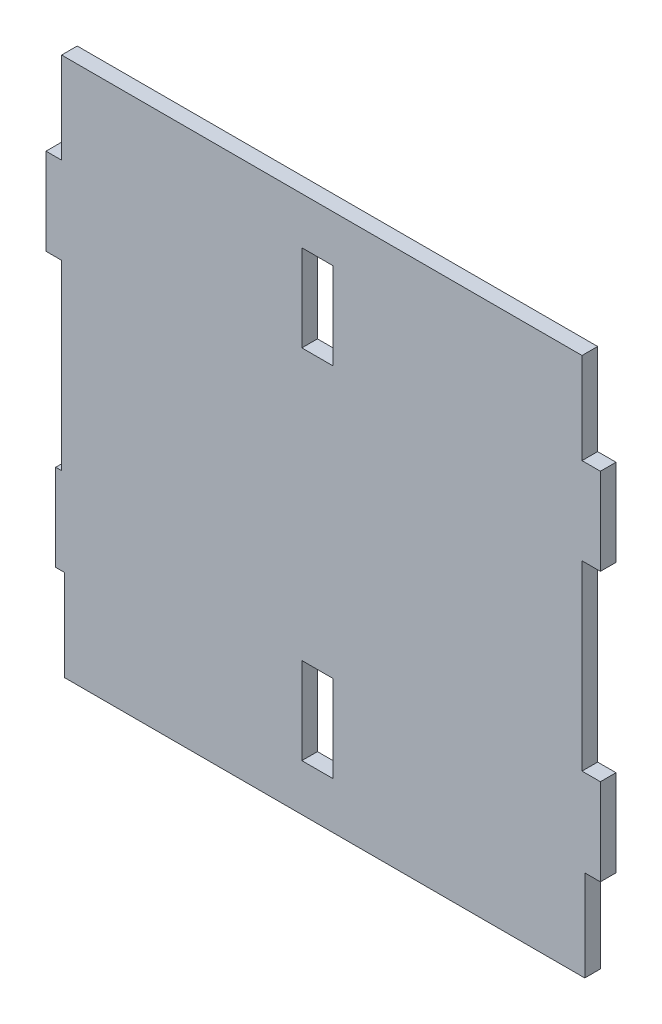
from build123d import *

# Parameters (mm, degrees)
BOSS_EXTRUDE3_DEPTH     = 18
CUT_EXTRUDE1_DEPTH      = 878.82331891
CUT_EXTRUDE1_DEPTH_BACK = 878.82331891
SKETCH2_W               = 36
SKETCH2_H               = 100


with BuildPart() as part:
    # Sketch1 → Boss-Extrude3 (new body)
    with BuildSketch(Plane.XY):
        Polygon((0, 0), (0, -105), (-18, -105), (-18, -205), (0, -205), (0, -415), (-6.780081157, -415), (-6.780081157, -515), (3.176196781, -514.99186428), (3.176196781, -619.99186428), (603.176196781, -619.99186428), (603.176196781, -515), (621.176196781, -515), (621.176196781, -415), (600, -415), (600, -205), (621.176196781, -205), (621.176196781, -105), (600, -105), (600, 0), align=None)
    extrude(amount=BOSS_EXTRUDE3_DEPTH)

    # Sketch2 → Cut-Extrude1 (cut, two sides: drawn at the far end of the back side and taken through both)
    with BuildSketch(Plane(origin=(0, 0, 0), x_dir=(-1, 0, 0), z_dir=(0, 0, -1)).offset(-CUT_EXTRUDE1_DEPTH_BACK)):
        with Locations((-294.972181327, -103.940998789)):
            Rectangle(SKETCH2_W, SKETCH2_H)
        with Locations((-294.972181327, -516.059001211)):
            Rectangle(SKETCH2_W, SKETCH2_H)
    extrude(amount=CUT_EXTRUDE1_DEPTH + CUT_EXTRUDE1_DEPTH_BACK, mode=Mode.SUBTRACT)


solid = part.part
